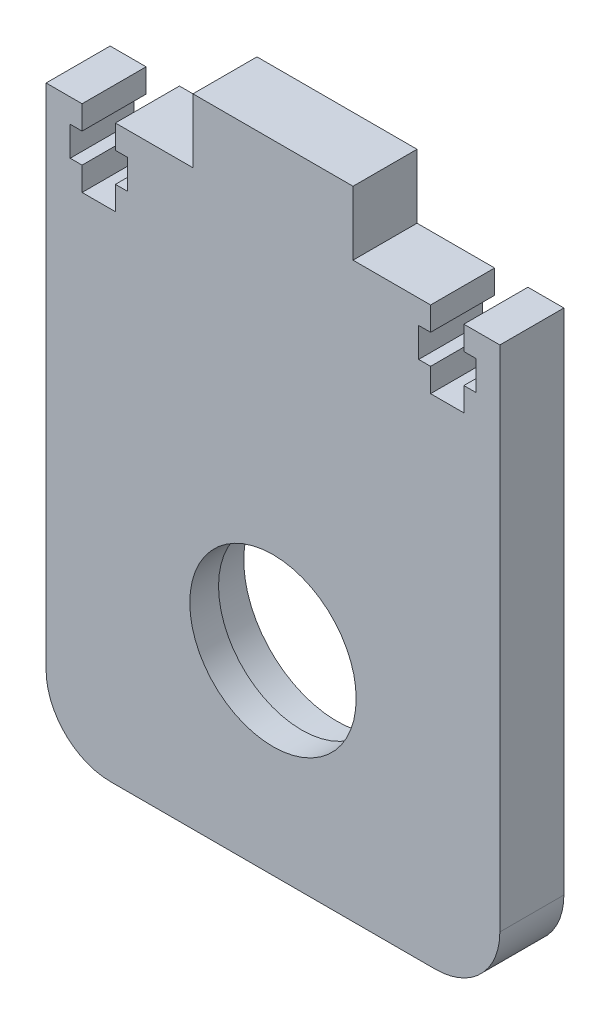
from build123d import *

# Parameters (mm, degrees)
SKETCH12_W           = 90
SKETCH12_H           = 113.63
BOSS_EXTRUDE10_DEPTH = 12.7
SKETCH25_R           = 18.5
CUT_EXTRUDE1_DEPTH   = 191.303286742
SKETCH26_R           = 18.5
SKETCH26_R_2         = 16.5
BOSS_EXTRUDE15_DEPTH = 5.7
FILLET1_R            = 12.8
CUT_EXTRUDE2_DEPTH   = 191.303286742
BOSS_EXTRUDE16_DEPTH = 12.7


with BuildPart() as part:
    # Sketch12 → Boss-Extrude10 (new body)
    with BuildSketch(Plane.XY):
        with Locations((107.125849364, 56.815)):
            Rectangle(SKETCH12_W, SKETCH12_H)
    extrude(amount=BOSS_EXTRUDE10_DEPTH)

    # Sketch25 → Cut-Extrude1 (cut, through all)
    with BuildSketch(Plane.XY.offset(12.7)):
        with Locations((107.125849364, 38.627603634)):
            Circle(SKETCH25_R)
    extrude(amount=-CUT_EXTRUDE1_DEPTH, mode=Mode.SUBTRACT)

    # Sketch26 → Boss-Extrude15 (add)
    with BuildSketch(Plane.XY.offset(12.7)):
        with Locations((107.125849364, 38.627603634)):
            Circle(SKETCH26_R)
        with Locations((107.125849364, 38.627603634)):
            Circle(SKETCH26_R_2, mode=Mode.SUBTRACT)
    extrude(amount=-BOSS_EXTRUDE15_DEPTH)

    # Fillet1
    fillet1_edges = [part.edges().sort_by_distance(p)[0] for p in [
        (152.125849364, 0, 6.35),
        (62.125849364, 0, 6.35),
    ]]
    fillet(fillet1_edges, radius=FILLET1_R)

    # Sketch27 → Cut-Extrude2 (cut, through all)
    with BuildSketch(Plane(origin=(0, 0, 0), x_dir=(-1, 0, 0), z_dir=(0, 0, -1))):
        Polygon((-138.383849364, 108.931), (-138.383849364, 113.63), (-144.987849364, 113.63), (-144.987849364, 108.931), (-147.349849364, 108.931), (-147.349849364, 103.089), (-144.987849364, 103.089), (-144.987849364, 98.39), (-138.383849364, 98.39), (-138.383849364, 103.089), (-136.021849364, 103.089), (-136.021849364, 108.931), align=None)
        Polygon((-69.263849364, 108.931), (-69.263849364, 113.63), (-75.867849364, 113.63), (-75.867849364, 108.931), (-78.229849364, 108.931), (-78.229849364, 103.089), (-75.867849364, 103.089), (-75.867849364, 98.39), (-69.263849364, 98.39), (-69.263849364, 103.089), (-66.901849364, 103.089), (-66.901849364, 108.931), align=None)
    extrude(amount=-CUT_EXTRUDE2_DEPTH, mode=Mode.SUBTRACT)

    # Sketch28 → Boss-Extrude16 (add)
    with BuildSketch(Plane(origin=(0, 113.63, 0), x_dir=(1, 0, 0), z_dir=(0, 1, 0))):
        Polygon((107.125849364, 0), (91.250849364, 0), (91.250849364, -12.7), (123.000849364, -12.7), (123.000849364, 0), align=None)
    extrude(amount=BOSS_EXTRUDE16_DEPTH)


solid = part.part
